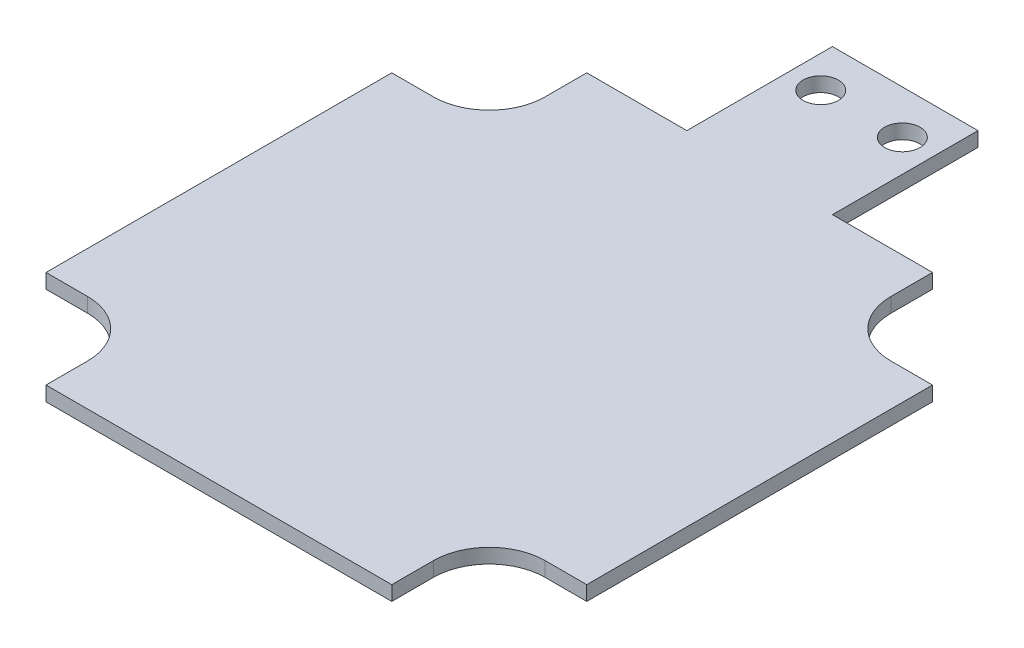
from build123d import *

# Parameters (mm, degrees)
BOSS_EXTRUDE1_DEPTH = 1.4
SKETCH2_R           = 1.25
CUT_EXTRUDE2_DEPTH  = 48.727979216
CUT_EXTRUDE3_DEPTH  = 48.727979216
SKETCH6_R           = 1.7
CUT_EXTRUDE4_DEPTH  = 48.727979216


with BuildPart() as part:
    # Sketch1 → Boss-Extrude1 (new body)
    with BuildSketch(Plane(origin=(0, 0, 0), x_dir=(1, 0, 0), z_dir=(0, 1, 0))):
        Polygon((26, -26), (-26, -26), (-26, 26), (-7, 26), (-7, 40), (7, 40), (7, 26), (26, 26), align=None)
    extrude(amount=BOSS_EXTRUDE1_DEPTH)

    # Sketch2 → Cut-Extrude2 (cut, through all)
    with BuildSketch(Plane(origin=(0, 0, 0), x_dir=(1, 0, 0), z_dir=(0, 1, 0))):
        with Locations((-22, 22)):
            Circle(SKETCH2_R)
        with Locations((22, 22)):
            Circle(SKETCH2_R)
        with Locations((22, -22)):
            Circle(SKETCH2_R)
        with Locations((-22, -22)):
            Circle(SKETCH2_R)
    extrude(amount=CUT_EXTRUDE2_DEPTH, mode=Mode.SUBTRACT)

    # Sketch5 → Cut-Extrude3 (cut, through all)
    with BuildSketch(Plane(origin=(0, 1.4, 0), x_dir=(1, 0, 0), z_dir=(0, 1, 0))):
        with BuildLine():
            Line((-26, 26), (-16.625, 26))
            Line((-16.625, 26), (-16.625, 22))
            ThreePointArc((-16.625, 22), (-18.199301051, 18.199301051), (-22, 16.625))
            Line((-22, 16.625), (-26, 16.625))
            Line((-26, 16.625), (-26, 26))
        make_face()
        with BuildLine():
            Line((22, 16.625), (26, 16.625))
            Line((26, 16.625), (26, 26))
            Line((26, 26), (16.625, 26))
            Line((16.625, 26), (16.625, 22))
            ThreePointArc((16.625, 22), (18.199301051, 18.199301051), (22, 16.625))
        make_face()
        with BuildLine():
            Line((-22, -16.625), (-26, -16.625))
            Line((-26, -16.625), (-26, -26))
            Line((-26, -26), (-16.625, -26))
            Line((-16.625, -26), (-16.625, -22))
            ThreePointArc((-16.625, -22), (-18.199301051, -18.199301051), (-22, -16.625))
        make_face()
        with BuildLine():
            Line((26, -26), (16.625, -26))
            Line((16.625, -26), (16.625, -22))
            ThreePointArc((16.625, -22), (18.199301051, -18.199301051), (22, -16.625))
            Line((22, -16.625), (26, -16.625))
            Line((26, -16.625), (26, -26))
        make_face()
    extrude(amount=-CUT_EXTRUDE3_DEPTH, mode=Mode.SUBTRACT)

    # Sketch6 → Cut-Extrude4 (cut, through all)
    with BuildSketch(Plane(origin=(0, 1.4, 0), x_dir=(1, 0, 0), z_dir=(0, 1, 0))):
        with Locations((3.925, 35.8)):
            Circle(SKETCH6_R)
        with Locations((-3.925, 35.8)):
            Circle(SKETCH6_R)
    extrude(amount=-CUT_EXTRUDE4_DEPTH, mode=Mode.SUBTRACT)


solid = part.part
